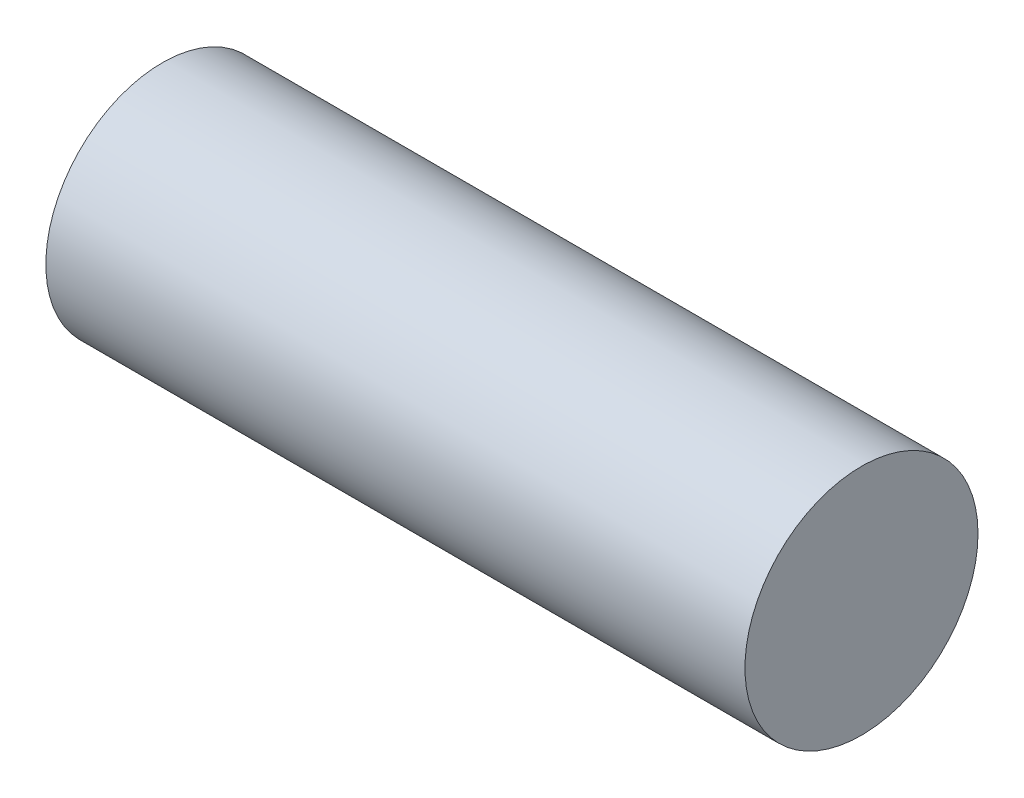
from build123d import *

# Parameters (mm, degrees)
SKETCH1_R           = 5
BOSS_EXTRUDE1_DEPTH = 30
SKETCH2_R           = 1.5
CUT_EXTRUDE1_DEPTH  = 20


with BuildPart() as part:
    # Sketch1 → Boss-Extrude1 (new body)
    with BuildSketch(Plane(origin=(0, 0, 0), x_dir=(0, 0, -1), z_dir=(1, 0, 0))):
        Circle(SKETCH1_R)
    extrude(amount=BOSS_EXTRUDE1_DEPTH)

    # Sketch2 → Cut-Extrude1 (cut)
    with BuildSketch(Plane.ZY):
        Circle(SKETCH2_R)
    extrude(amount=-CUT_EXTRUDE1_DEPTH, mode=Mode.SUBTRACT)


solid = part.part
